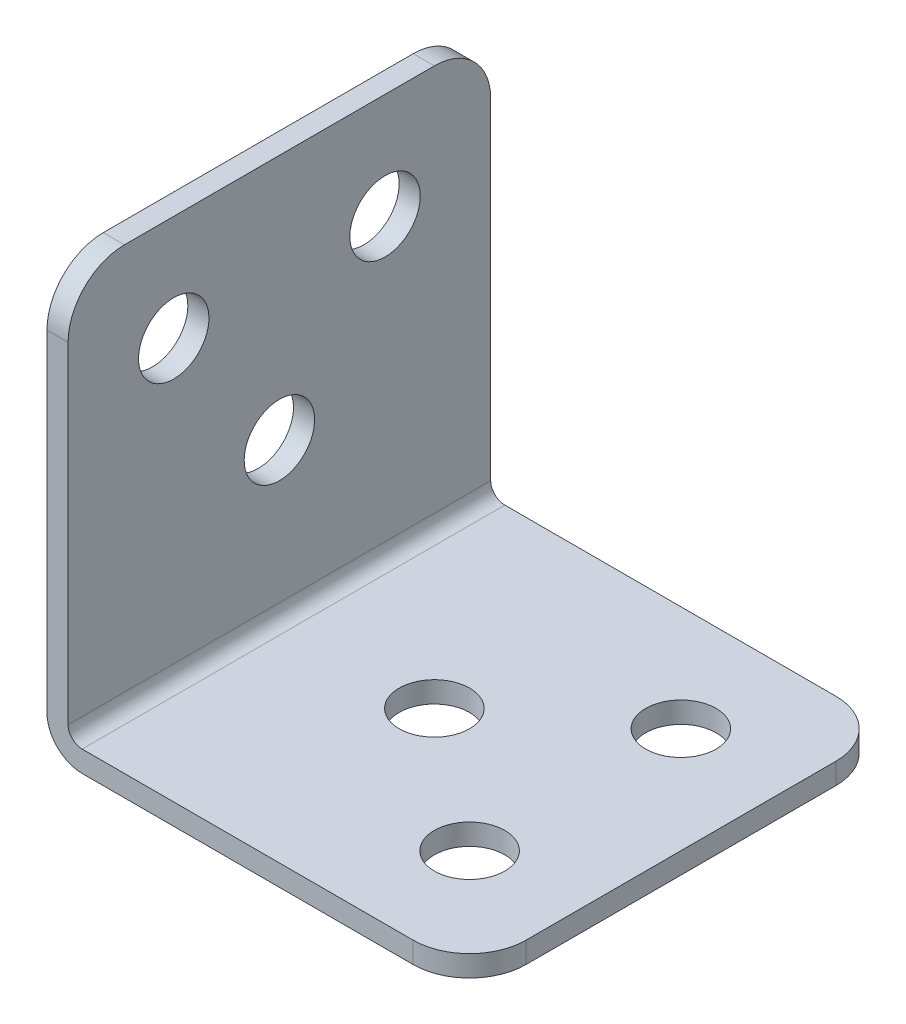
from build123d import *

# Parameters (mm, degrees)
EXTRUDE_1_DEPTH     = 30
SKETCH_2_R          = 2.5
CUT_EXTRUDE_1_DEPTH = 40
SKETCH_3_R          = 2.5
CUT_EXTRUDE_2_DEPTH = 40
FILLET_1_R          = 4


with BuildPart() as part:
    # Эскиз1 → Бобышка-Вытянуть1 (new body)
    with BuildSketch(Plane.XY):
        with BuildLine():
            Line((-2.5, 27.5), (-2.5, 0))
            ThreePointArc((-2.5, 0), (-1.767766953, -1.767766953), (0, -2.5))
            Line((0, -2.5), (27.5, -2.5))
            Line((27.5, -2.5), (27.5, -1))
            Line((27.5, -1), (0, -1))
            ThreePointArc((0, -1), (-0.707106781, -0.707106781), (-1, 0))
            Line((-1, 0), (-1, 27.5))
            Line((-1, 27.5), (-2.5, 27.5))
        make_face()
    extrude(amount=EXTRUDE_1_DEPTH)

    # Эскиз2 → Вырез-Вытянуть1 (cut)
    with BuildSketch(Plane.ZY.offset(2.5)):
        with Locations(Location((7.5, 20, 0), (0, 0, 270))):
            Circle(SKETCH_2_R)
        with Locations(Location((22.5, 20, 0), (0, 0, 270))):
            Circle(SKETCH_2_R)
        with Locations(Location((15, 10, 0), (0, 0, 270))):
            Circle(SKETCH_2_R)
    extrude(amount=-CUT_EXTRUDE_1_DEPTH, mode=Mode.SUBTRACT)

    # Эскиз3 → Вырез-Вытянуть2 (cut)
    with BuildSketch(Plane.XZ.offset(2.5)):
        with Locations((20, 7.5)):
            Circle(SKETCH_3_R)
        with Locations((20, 22.5)):
            Circle(SKETCH_3_R)
        with Locations((10, 15)):
            Circle(SKETCH_3_R)
    extrude(amount=-CUT_EXTRUDE_2_DEPTH, mode=Mode.SUBTRACT)

    # Скругление1
    fillet_1_edges = [part.edges().sort_by_distance(p)[0] for p in [
        (-1.75, 27.5, 0),
        (27.5, -1.75, 30),
        (-1.75, 27.5, 30),
        (27.5, -1.75, 0),
    ]]
    fillet(fillet_1_edges, radius=FILLET_1_R)


solid = part.part
